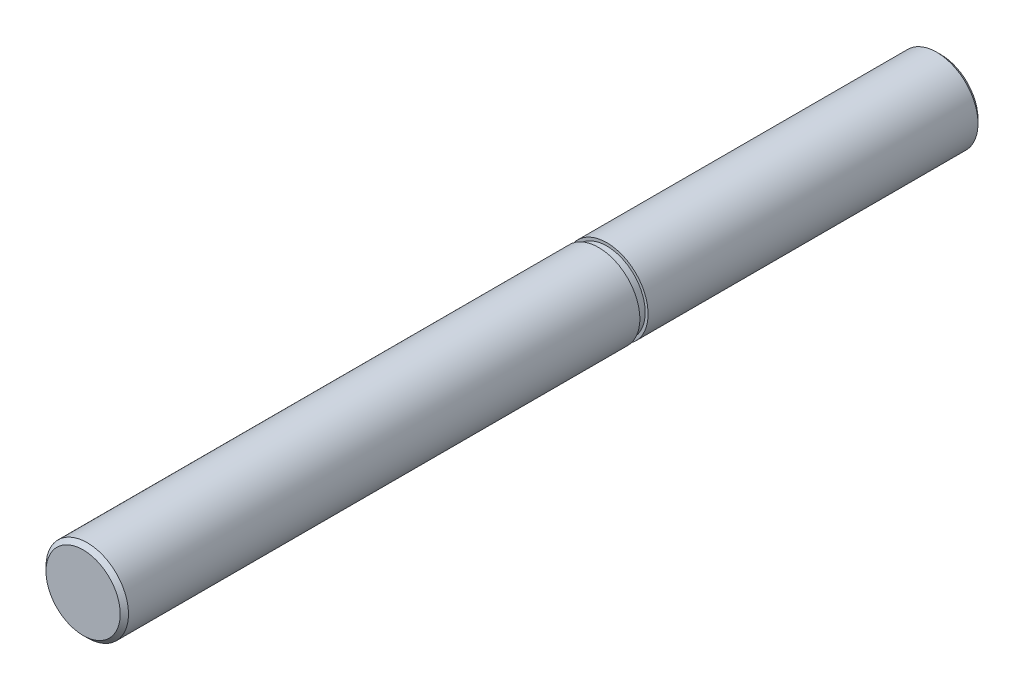
from build123d import *

# Parameters (mm, degrees)
SKETCH_1_R      = 5
EXTRUDE_1_DEPTH = 104
SKETCH_2_W      = 3.498862739
SKETCH_2_H      = 1
CHAMFER_1_SIZE  = 0.5


with BuildPart() as part:
    # 草图1 → 拉伸1 (new body)
    with BuildSketch(Plane.XY):
        with Locations(Location((0, 0, 0), (0, 0, 180))):
            Circle(SKETCH_1_R)
    extrude(amount=EXTRUDE_1_DEPTH)

    # 草图2 → 切除-旋转1 (revolve, cut)
    with BuildSketch(Plane(origin=(0, 0, 0), x_dir=(1, 0, 0), z_dir=(0, 1, 0)), mode=Mode.PRIVATE) as cut_revolve_1_sk:
        with Locations((6.39943137, -41)):
            Rectangle(SKETCH_2_W, SKETCH_2_H)
    revolve(cut_revolve_1_sk.sketch.rotate(Axis((0, 0, 104), (0, 0, -1)), 180), axis=Axis((0, 0, 104), (0, 0, -1)), mode=Mode.SUBTRACT)

    # 倒角1
    chamfer_1_edges = [part.edges().sort_by_distance(p)[0] for p in [
        (5, 0, 0),
        (5, 0, 104),
    ]]
    chamfer(chamfer_1_edges, length=CHAMFER_1_SIZE)


solid = part.part
